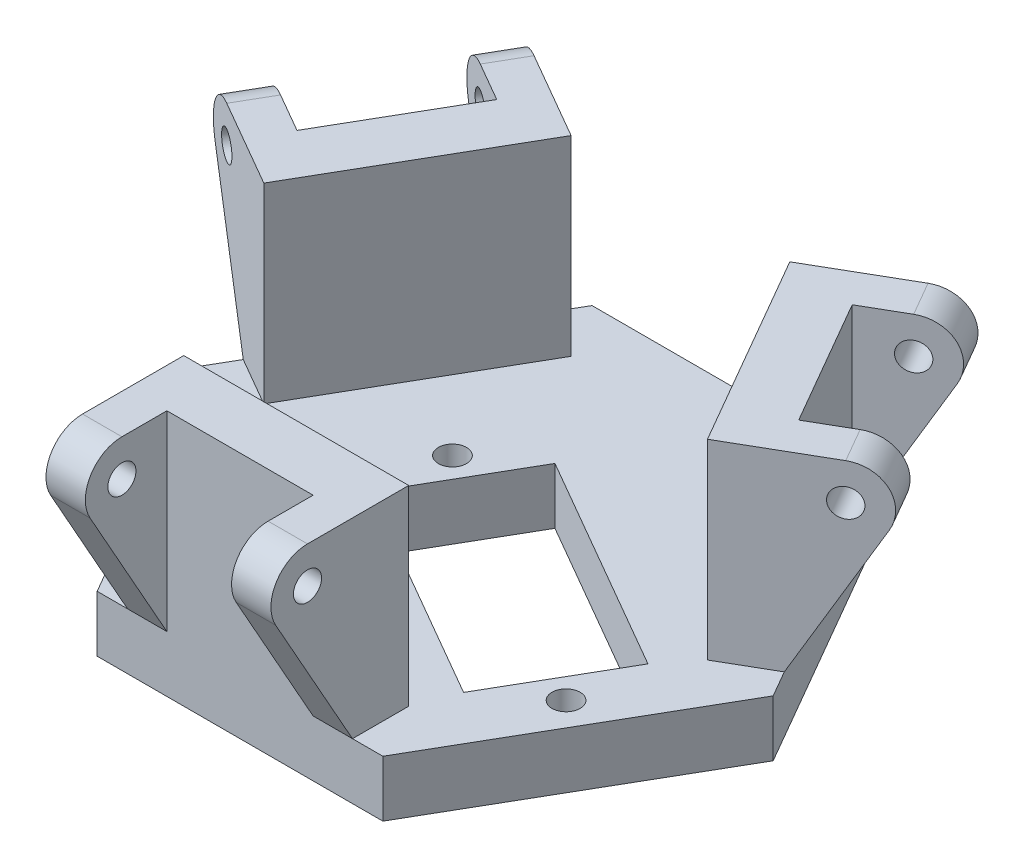
from build123d import *

# Parameters (mm, degrees)
BOSS_EXTRUDE1_DEPTH         = 5
SKETCH4_W                   = 20
SKETCH4_H                   = 5
BOSS_EXTRUDE3_DEPTH         = 17
BOSS_EXTRUDE2_START         = 6.5
SKETCH2_R                   = 1.25
BOSS_EXTRUDE2_DEPTH         = 3.5
CIRPATTERN1_COUNT           = 3
CIRPATTERN1_COPY_1_SKETCH_W = 20
CIRPATTERN1_COPY_1_SKETCH_H = 5
CIRPATTERN1_COPY_1_DEPTH    = 17
CIRPATTERN1_COPY_2_SKETCH_W = 20
CIRPATTERN1_COPY_2_SKETCH_H = 5
CIRPATTERN1_COPY_2_DEPTH    = 17
CIRPATTERN1_START           = 6.5
CIRPATTERN1_COPY_3_SKETCH_R = 1.25
CIRPATTERN1_COPY_3_DEPTH    = 3.5
CIRPATTERN1_COPY_4_SKETCH_R = 1.25
CIRPATTERN1_COPY_4_DEPTH    = 3.5
CUT_EXTRUDE1_REACH          = 47.437
CUT_EXTRUDE2_REACH          = 47.437
SKETCH6_R                   = 1.25


with BuildPart() as part:
    # Sketch1 → Boss-Extrude1 (new body)
    with BuildSketch(Plane(origin=(0, 0, 0), x_dir=(1, 0, 0), z_dir=(0, 1, 0))):
        Polygon((25.403411844, 0), (12.701705922, 22), (-12.701705922, 22), (-25.403411844, 0), (-12.701705922, -22), (12.701705922, -22), align=None)
    extrude(amount=BOSS_EXTRUDE1_DEPTH)

    # Sketch4 → Boss-Extrude3 (add)
    with BuildSketch(Plane(origin=(0, 5, 0), x_dir=(1, 0, 0), z_dir=(0, 1, 0))):
        with Locations((0, -19.5)):
            Rectangle(SKETCH4_W, SKETCH4_H)
    boss_extrude3 = extrude(amount=BOSS_EXTRUDE3_DEPTH)

    # Sketch2 → Boss-Extrude2 (add)
    with BuildSketch(Plane(origin=(0, 0, 0), x_dir=(0, 0, -1), z_dir=(1, 0, 0)).offset(BOSS_EXTRUDE2_START)):
        with BuildLine():
            Line((-22, 22), (-26, 22))
            ThreePointArc((-26, 22), (-28.805149023, 20.391230928), (-28.83316759, 17.157623974))
            Line((-28.83316759, 17.157623974), (-22, 5))
            Line((-22, 5), (-22, 22))
        make_face()
        with Locations(Location((-26, 18.75, 0), (0, 0, 180))):
            Circle(SKETCH2_R, mode=Mode.SUBTRACT)
    boss_extrude2 = extrude(amount=BOSS_EXTRUDE2_DEPTH)

    # Mirror1: Boss-Extrude3, Boss-Extrude2 across plane
    add(boss_extrude3.mirror(Plane(origin=(0, 0, 0), x_dir=(0, 0, 1), z_dir=(1, 0, 0))))
    add(boss_extrude2.mirror(Plane(origin=(0, 0, 0), x_dir=(0, 0, 1), z_dir=(1, 0, 0))))

    # CirPattern1: Boss-Extrude3, Boss-Extrude2 ×3 about axis
    cirpattern1_axis = Axis((0, 0, 0), (0, 1, 0))
    add([boss_extrude3.rotate(cirpattern1_axis, i * 360 / CIRPATTERN1_COUNT) for i in range(1, CIRPATTERN1_COUNT)])
    add([boss_extrude2.rotate(cirpattern1_axis, i * 360 / CIRPATTERN1_COUNT) for i in range(1, CIRPATTERN1_COUNT)])

    # CirPattern1 copy 1 sketch → CirPattern1 copy 1 (add)
    with BuildSketch(Plane(origin=(0, 5, 0), x_dir=(0.4999999999999998, 0, 0.8660254037844387), z_dir=(0, 1, 0))):
        with Locations((0, 19.5)):
            Rectangle(CIRPATTERN1_COPY_1_SKETCH_W, CIRPATTERN1_COPY_1_SKETCH_H)
    extrude(amount=CIRPATTERN1_COPY_1_DEPTH)

    # CirPattern1 copy 2 sketch → CirPattern1 copy 2 (add)
    with BuildSketch(Plane(origin=(0, 5, 0), x_dir=(0.5000000000000004, 0, -0.8660254037844384), z_dir=(0, 1, 0))):
        with Locations((0, 19.5)):
            Rectangle(CIRPATTERN1_COPY_2_SKETCH_W, CIRPATTERN1_COPY_2_SKETCH_H)
    extrude(amount=CIRPATTERN1_COPY_2_DEPTH)

    # CirPattern1 copy 3 sketch → CirPattern1 copy 3 (add)
    with BuildSketch(Plane(origin=(0, 0, 0), x_dir=(-0.8660254037844387, 0, 0.4999999999999998), z_dir=(0.4999999999999998, 0, 0.8660254037844387)).offset(CIRPATTERN1_START)):
        with BuildLine():
            Line((-22, -22), (-26, -22))
            ThreePointArc((-26, -22), (-28.805149023, -20.391230928), (-28.83316759, -17.157623974))
            Line((-28.83316759, -17.157623974), (-22, -5))
            Line((-22, -5), (-22, -22))
        make_face()
        with Locations((-26, -18.75)):
            Circle(CIRPATTERN1_COPY_3_SKETCH_R, mode=Mode.SUBTRACT)
    extrude(amount=CIRPATTERN1_COPY_3_DEPTH)

    # CirPattern1 copy 4 sketch → CirPattern1 copy 4 (add)
    with BuildSketch(Plane(origin=(0, 0, 0), x_dir=(0.8660254037844384, 0, 0.5000000000000004), z_dir=(0.5000000000000004, 0, -0.8660254037844384)).offset(CIRPATTERN1_START)):
        with BuildLine():
            Line((-22, -22), (-26, -22))
            ThreePointArc((-26, -22), (-28.805149023, -20.391230928), (-28.83316759, -17.157623974))
            Line((-28.83316759, -17.157623974), (-22, -5))
            Line((-22, -5), (-22, -22))
        make_face()
        with Locations((-26, -18.75)):
            Circle(CIRPATTERN1_COPY_4_SKETCH_R, mode=Mode.SUBTRACT)
    extrude(amount=CIRPATTERN1_COPY_4_DEPTH)

    # Sketch3 → Cut-Extrude1 (cut, up to next)
    with BuildSketch(Plane(origin=(0, 5, 0), x_dir=(1, 0, 0), z_dir=(0, 1, 0)), mode=Mode.PRIVATE) as cut_extrude1_sk1:
        Polygon((-2.196152423, 8.196152423), (17.376021703, -3.103847577), (11.376021703, -13.496152423), (-8.196152423, -2.196152423), align=None)
    cut_extrude1_tool1 = extrude(cut_extrude1_sk1.sketch, amount=-CUT_EXTRUDE1_REACH, mode=Mode.PRIVATE) & part.part
    add(cut_extrude1_tool1.solids().sort_by_distance((4.589935, 5, 2.65))[0], mode=Mode.SUBTRACT)

    # Sketch6 → Cut-Extrude2 (cut, up to next)
    with BuildSketch(Plane(origin=(0, 5, 0), x_dir=(1, 0, 0), z_dir=(0, 1, 0)), mode=Mode.PRIVATE) as cut_extrude2_sk1:
        with Locations(Location((-7.361215932, 4.25, 0), (0, 0, 270))):
            Circle(SKETCH6_R)
    cut_extrude2_tool1 = extrude(cut_extrude2_sk1.sketch, amount=-CUT_EXTRUDE2_REACH, mode=Mode.PRIVATE) & part.part
    # Sketch6 → Cut-Extrude2 (cut, up to next)
    with BuildSketch(Plane(origin=(0, 5, 0), x_dir=(1, 0, 0), z_dir=(0, 1, 0)), mode=Mode.PRIVATE) as cut_extrude2_sk2:
        with Locations(Location((16.541085212, -9.55, 0), (0, 0, 270))):
            Circle(SKETCH6_R)
    cut_extrude2_tool2 = extrude(cut_extrude2_sk2.sketch, amount=-CUT_EXTRUDE2_REACH, mode=Mode.PRIVATE) & part.part
    add(cut_extrude2_tool1.solids().sort_by_distance((-7.361216, 5, -4.25))[0], mode=Mode.SUBTRACT)
    add(cut_extrude2_tool2.solids().sort_by_distance((16.541085, 5, 9.55))[0], mode=Mode.SUBTRACT)


solid = part.part
